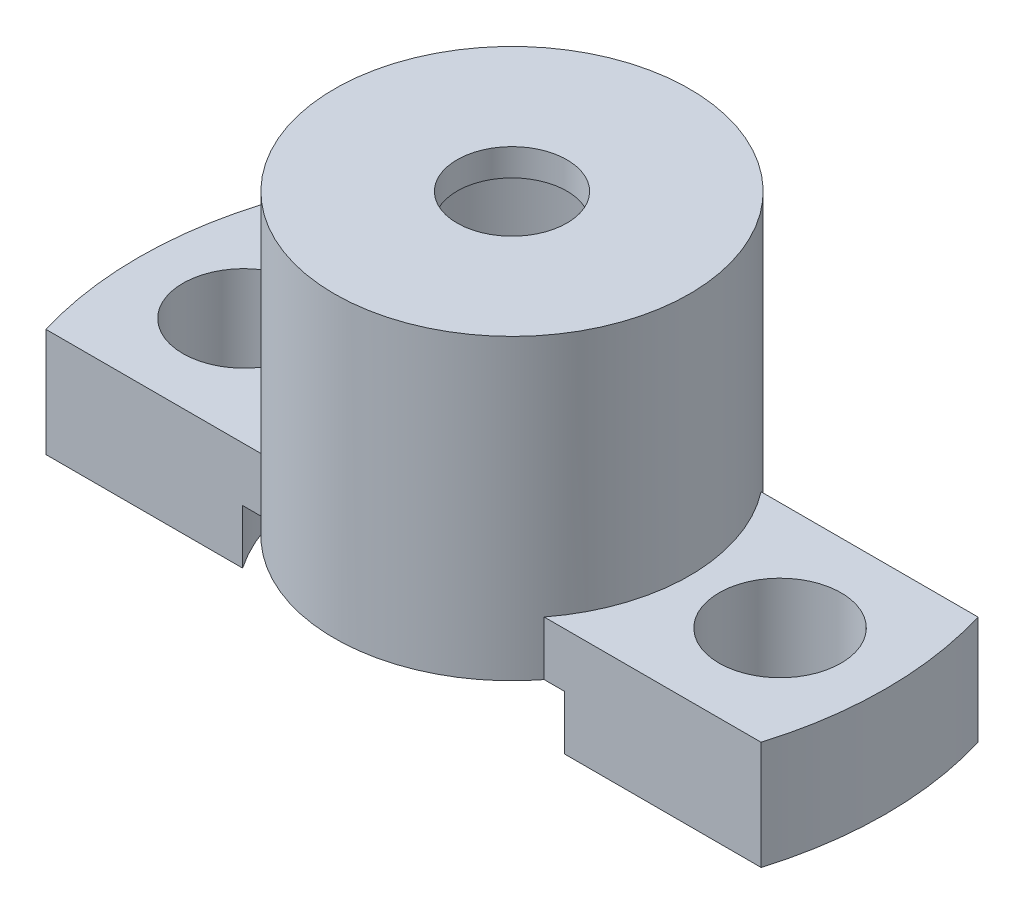
from build123d import *

# Parameters (mm, degrees)
SKETCH5_R                             = 6.55
SKETCH5_R_2                           = 2.025
EXT_TOPMAGNETROOM_DEPTH               = 1
EXT_MAGNETROOM_START                  = 4
SKETCH7_R                             = 6.55
SKETCH7_R_2                           = 5.05
EXT_MAGNETROOM_DEPTH                  = 4
BOTTOM_ARMS_FIXING_WITH_SUPPORT_DEPTH = 2
BOTTOM_START                          = 2
BOTTOM_FIXING_ARMS_END_DEPTH          = 2
ESQUISSE1_R                           = 2
EXT_HOLEMOUNTED_DEPTH                 = 16.773179512
SKETCH10_R                            = 6.55
SKETCH10_R_2                          = 5.05
CHAMBER_DEPTH                         = 5
SKETCH11_R                            = 6.55
SKETCH11_R_2                          = 2.025
BOSS_EXTRUDE4_DEPTH                   = 1
ESQUISSE3_R                           = 3
ENL_V_MAT_EXTRU_2_DEPTH               = 18.714208758
SKETCH13_R                            = 5.2
CUT_EXTRUDE2_DEPTH                    = 4
SKETCH14_R                            = 2.25
CUT_EXTRUDE3_DEPTH                    = 10
SKETCH15_R                            = 6.1
CUT_EXTRUDE4_DEPTH                    = 4


with BuildPart() as part:
    # Sketch5 → Ext_TopMagnetRoom (new body)
    with BuildSketch(Plane(origin=(0, 0, 0), x_dir=(-1, 0, 0), z_dir=(0, 1, 0))):
        with Locations(Location((0, 0, 0), (0, 0, 90))):
            Circle(SKETCH5_R)
        with Locations(Location((0, 0, 0), (0, 0, 90))):
            Circle(SKETCH5_R_2, mode=Mode.SUBTRACT)
    extrude(amount=EXT_TOPMAGNETROOM_DEPTH)

    # Sketch7 → Ext_MagnetRoom (add)
    with BuildSketch(Plane.XZ.offset(EXT_MAGNETROOM_START)):
        with Locations(Location((0, 0, 0), (0, 0, 270))):
            Circle(SKETCH7_R)
        with Locations(Location((0, 0, 0), (0, 0, 270))):
            Circle(SKETCH7_R_2, mode=Mode.SUBTRACT)
    extrude(amount=-EXT_MAGNETROOM_DEPTH)

    # Sketch6 → Bottom-arms fixing with support (add)
    with BuildSketch(Plane.XZ.offset(4)):
        with BuildLine():
            Line((13.186761996, -4), (5.186761996, -4))
            ThreePointArc((5.186761996, -4), (6.55, 0), (5.186761996, 4))
            Line((5.186761996, 4), (13.186761996, 4))
            ThreePointArc((13.186761996, 4), (13.780083161, 0), (13.186761996, -4))
        make_face()
        with BuildLine():
            Line((-13.186761996, -4), (-5.186761996, -4))
            ThreePointArc((-5.186761996, -4), (-6.55, 0), (-5.186761996, 4))
            Line((-5.186761996, 4), (-13.186761996, 4))
            ThreePointArc((-13.186761996, 4), (-13.780083161, 0), (-13.186761996, -4))
        make_face()
    extrude(amount=-BOTTOM_ARMS_FIXING_WITH_SUPPORT_DEPTH)

    # Sketch9 → Bottom- Fixing arms End (add)
    with BuildSketch(Plane.XZ.offset(4).offset(BOTTOM_START)):
        with BuildLine():
            Line((13.186761996, 4), (5.936761996, 4))
            ThreePointArc((5.936761996, 4), (7.158571296, 0), (5.936761996, -4))
            Line((5.936761996, -4), (13.186761996, -4))
            ThreePointArc((13.186761996, -4), (13.780083161, 0), (13.186761996, 4))
        make_face()
        with BuildLine():
            Line((-13.186761996, -4), (-5.936761996, -4))
            ThreePointArc((-5.936761996, -4), (-7.158571296, 0), (-5.936761996, 4))
            Line((-5.936761996, 4), (-13.186761996, 4))
            ThreePointArc((-13.186761996, 4), (-13.780083161, 0), (-13.186761996, -4))
        make_face()
    extrude(amount=-BOTTOM_FIXING_ARMS_END_DEPTH)

    # Esquisse1 → Ext_HoleMounted (cut, through all)
    with BuildSketch(Plane(origin=(0, -2, 0), x_dir=(1, 0, 0), z_dir=(0, 1, 0))):
        with Locations(Location((-9.886761996, 0, 0), (0, 0, 270))):
            Circle(ESQUISSE1_R)
        with Locations(Location((9.886761996, 0, 0), (0, 0, 270))):
            Circle(ESQUISSE1_R)
    extrude(amount=-EXT_HOLEMOUNTED_DEPTH, mode=Mode.SUBTRACT)

    # Sketch10 → chamber (add)
    with BuildSketch(Plane(origin=(0, 1, 0), x_dir=(1, 0, 0), z_dir=(0, 1, 0))):
        with Locations(Location((0, 0, 0), (0, 0, 142.360804213))):
            Circle(SKETCH10_R)
        with Locations(Location((0, 0, 0), (0, 0, 90))):
            Circle(SKETCH10_R_2, mode=Mode.SUBTRACT)
    extrude(amount=CHAMBER_DEPTH)

    # Sketch11 → Boss-Extrude4 (add)
    with BuildSketch(Plane(origin=(0, 6, 0), x_dir=(1, 0, 0), z_dir=(0, 1, 0))):
        with Locations(Location((0, 0, 0), (0, 0, 142.360804213))):
            Circle(SKETCH11_R)
        with Locations(Location((0, 0, 0), (0, 0, 270))):
            Circle(SKETCH11_R_2, mode=Mode.SUBTRACT)
    extrude(amount=BOSS_EXTRUDE4_DEPTH)

    # Esquisse3 → Enlèv. mat.-Extru.2 (cut, through all)
    with BuildSketch(Plane(origin=(0, -2, 0), x_dir=(1, 0, 0), z_dir=(0, 1, 0))):
        with Locations((9.886761996, 0)):
            Circle(ESQUISSE3_R)
        with Locations((-9.886761996, 0)):
            Circle(ESQUISSE3_R)
    extrude(amount=ENL_V_MAT_EXTRU_2_DEPTH, mode=Mode.SUBTRACT)

    # Sketch13 → Cut-Extrude2 (cut)
    with BuildSketch(Plane.XZ.offset(4)):
        with Locations(Location((0, 0, 0), (0, 0, 270))):
            Circle(SKETCH13_R)
    extrude(amount=-CUT_EXTRUDE2_DEPTH, mode=Mode.SUBTRACT)

    # Sketch14 → Cut-Extrude3 (cut)
    with BuildSketch(Plane(origin=(0, -2, 0), x_dir=(1, 0, 0), z_dir=(0, 1, 0))):
        with Locations(Location((-9.886761996, 0, 0), (0, 0, 270))):
            Circle(SKETCH14_R)
        with Locations(Location((9.886761996, 0, 0), (0, 0, 270))):
            Circle(SKETCH14_R)
    extrude(amount=-CUT_EXTRUDE3_DEPTH, mode=Mode.SUBTRACT)

    # Sketch15 → Cut-Extrude4 (cut)
    with BuildSketch(Plane.XZ.offset(4)):
        with Locations(Location((0, 0, 0), (0, 0, 270))):
            Circle(SKETCH15_R)
    extrude(amount=-CUT_EXTRUDE4_DEPTH, mode=Mode.SUBTRACT)


solid = part.part
